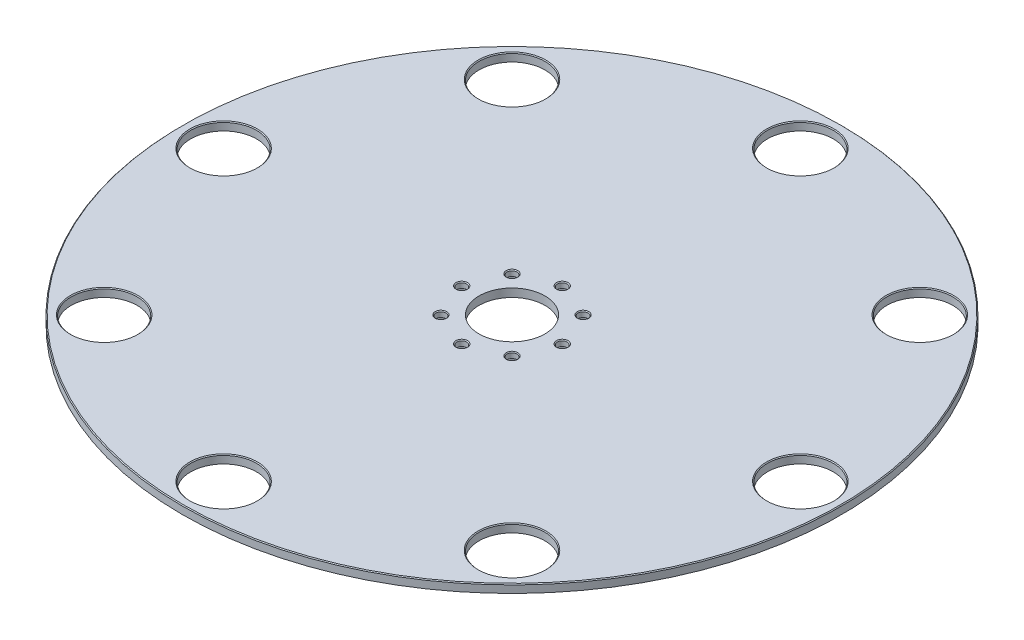
from build123d import *

# Parameters (mm, degrees)
SKETCH2_R            = 400
SKETCH2_R_2          = 40
BOSS_EXTRUDE10_DEPTH = 10
CHAMFER1_SIZE        = 1
SKETCH13_R           = 6
CUT_EXTRUDE1_DEPTH   = 7
CHAMFER2_SIZE        = 1
SKETCH14_R           = 4
CUT_EXTRUDE2_DEPTH   = 3


with BuildPart() as part:
    # Sketch2 → Boss-Extrude10 (new body)
    with BuildSketch(Plane(origin=(0, 0, 0), x_dir=(1, 0, 0), z_dir=(0, 1, 0))):
        with Locations(Location((0, 0, 0), (0, 0, 270))):
            Circle(SKETCH2_R)
        with Locations(Location((0, 0, 0), (0, 0, 270))):
            Circle(SKETCH2_R_2, mode=Mode.SUBTRACT)
        with Locations(Location((0, 350, 0), (0, 0, 270))):
            Circle(SKETCH2_R_2, mode=Mode.SUBTRACT)
        with Locations(Location((247.487373415, 247.487373415, 0), (0, 0, 270))):
            Circle(SKETCH2_R_2, mode=Mode.SUBTRACT)
        with Locations(Location((350, 0, 0), (0, 0, 270))):
            Circle(SKETCH2_R_2, mode=Mode.SUBTRACT)
        with Locations(Location((247.487373415, -247.487373415, 0), (0, 0, 270))):
            Circle(SKETCH2_R_2, mode=Mode.SUBTRACT)
        with Locations(Location((0, -350, 0), (0, 0, 270))):
            Circle(SKETCH2_R_2, mode=Mode.SUBTRACT)
        with Locations(Location((-247.487373415, -247.487373415, 0), (0, 0, 270))):
            Circle(SKETCH2_R_2, mode=Mode.SUBTRACT)
        with Locations(Location((-350, 0, 0), (0, 0, 270))):
            Circle(SKETCH2_R_2, mode=Mode.SUBTRACT)
        with Locations(Location((-247.487373415, 247.487373415, 0), (0, 0, 270))):
            Circle(SKETCH2_R_2, mode=Mode.SUBTRACT)
    extrude(amount=BOSS_EXTRUDE10_DEPTH)

    # Chamfer1
    chamfer1_edges = [part.edges().sort_by_distance(p)[0] for p in [
        (247.487373415, 10, -287.487373415),
        (350, 10, -40),
        (247.487373415, 10, 207.487373415),
        (0, 10, 310),
        (-247.487373415, 10, 207.487373415),
        (-350, 10, -40),
        (-247.487373415, 10, -287.487373415),
        (0, 10, -400),
        (0, 10, -390),
    ]]
    chamfer(chamfer1_edges, length=CHAMFER1_SIZE)

    # Sketch13 → Cut-Extrude1 (cut)
    with BuildSketch(Plane(origin=(0, 10, 0), x_dir=(1, 0, 0), z_dir=(0, 1, 0))):
        with Locations(Location((-61, 0, 0), (0, 0, 270))):
            Circle(SKETCH13_R)
        with Locations(Location((-43.133513652, 43.133513652, 0), (0, 0, 270))):
            Circle(SKETCH13_R)
        with Locations(Location((0, 61, 0), (0, 0, 270))):
            Circle(SKETCH13_R)
        with Locations(Location((43.133513652, 43.133513652, 0), (0, 0, 270))):
            Circle(SKETCH13_R)
        with Locations(Location((61, 0, 0), (0, 0, 270))):
            Circle(SKETCH13_R)
        with Locations(Location((43.133513652, -43.133513652, 0), (0, 0, 270))):
            Circle(SKETCH13_R)
        with Locations(Location((0, -61, 0), (0, 0, 270))):
            Circle(SKETCH13_R)
        with Locations(Location((-43.133513652, -43.133513652, 0), (0, 0, 270))):
            Circle(SKETCH13_R)
    extrude(amount=-CUT_EXTRUDE1_DEPTH, mode=Mode.SUBTRACT)

    # Chamfer2
    chamfer2_edges = [part.edges().sort_by_distance(p)[0] for p in [
        (-61, 10, -6),
        (-43.133513652, 10, -49.133513652),
        (0, 10, -67),
        (43.133513652, 10, -49.133513652),
        (61, 10, -6),
        (43.133513652, 10, 37.133513652),
        (0, 10, 55),
        (-43.133513652, 10, 37.133513652),
    ]]
    chamfer(chamfer2_edges, length=CHAMFER2_SIZE)

    # Sketch14 → Cut-Extrude2 (cut)
    with BuildSketch(Plane.XZ):
        with Locations(Location((-61, 0, 0), (0, 0, 270))):
            Circle(SKETCH14_R)
        with Locations(Location((-43.133513652, 43.133513652, 0), (0, 0, 270))):
            Circle(SKETCH14_R)
        with Locations(Location((0, 61, 0), (0, 0, 270))):
            Circle(SKETCH14_R)
        with Locations(Location((43.133513652, 43.133513652, 0), (0, 0, 270))):
            Circle(SKETCH14_R)
        with Locations(Location((61, 0, 0), (0, 0, 270))):
            Circle(SKETCH14_R)
        with Locations(Location((43.133513652, -43.133513652, 0), (0, 0, 270))):
            Circle(SKETCH14_R)
        with Locations(Location((0, -61, 0), (0, 0, 270))):
            Circle(SKETCH14_R)
        with Locations(Location((-43.133513652, -43.133513652, 0), (0, 0, 270))):
            Circle(SKETCH14_R)
    extrude(amount=-CUT_EXTRUDE2_DEPTH, mode=Mode.SUBTRACT)


solid = part.part
